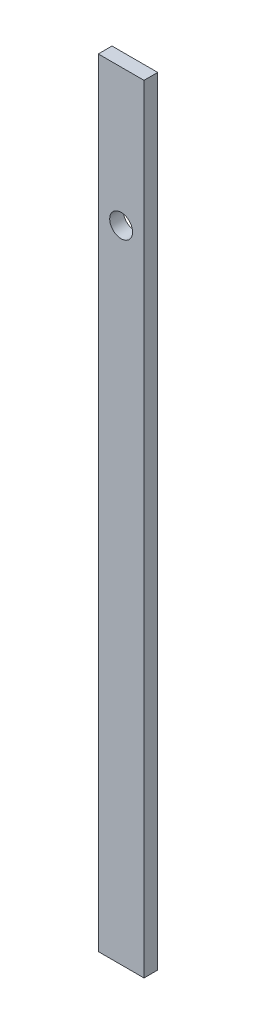
from build123d import *

# Parameters (mm, degrees)
SKETCH_1_W      = 10
SKETCH_1_H      = 170
SKETCH_1_R      = 2.5
EXTRUDE_1_DEPTH = 3


with BuildPart() as part:
    # 草圖1 → 填料-伸長1 (new body)
    with BuildSketch(Plane.XY):
        Rectangle(SKETCH_1_W, SKETCH_1_H)
        with Locations((0, 55)):
            Circle(SKETCH_1_R, mode=Mode.SUBTRACT)
    extrude(amount=EXTRUDE_1_DEPTH)


solid = part.part
